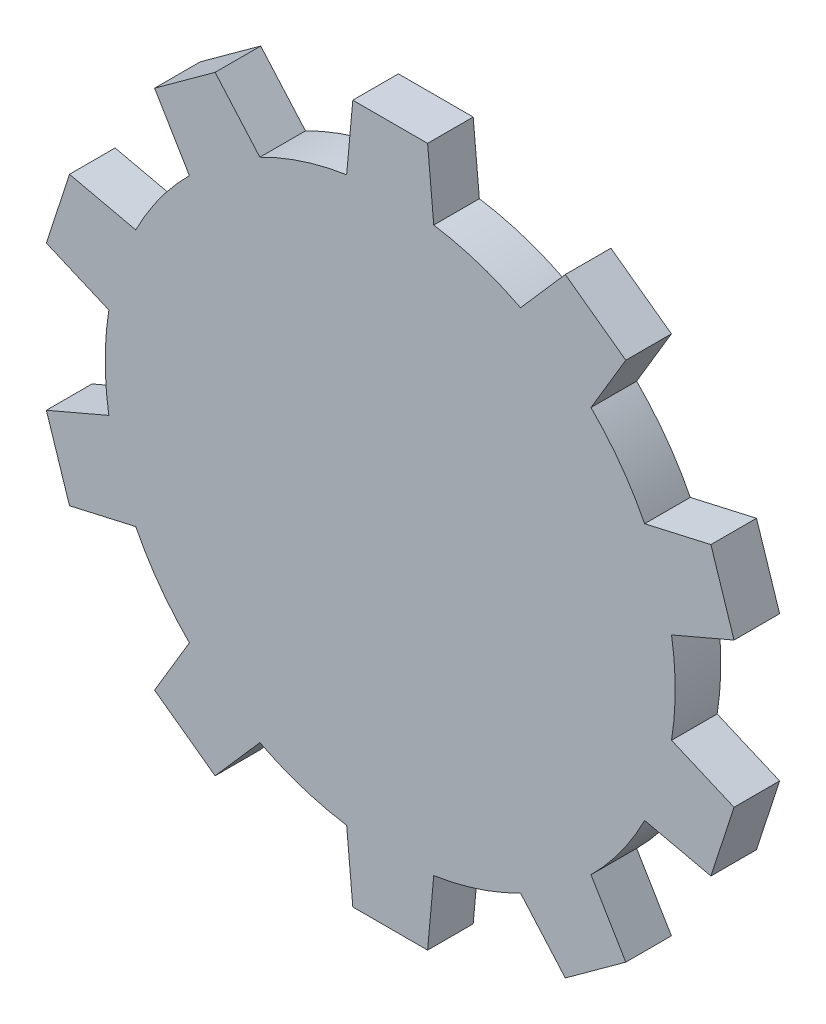
from build123d import *

# Parameters (mm, degrees)
SALIENTE_EXTRUIR1_DEPTH = 2


with BuildPart() as part:
    # Croquis1 → Saliente-Extruir1 (new body)
    with BuildSketch(Plane.XY):
        with BuildLine():
            Line((-1.909727018, 12.353256361), (-1.639945169, 15.320856699))
            Line((-1.639945169, 15.320856699), (1.639945169, 15.320856699))
            Line((1.639945169, 15.320856699), (1.909727018, 12.353256361))
            ThreePointArc((1.909727018, 12.353256361), (3.86271243, 11.888206454), (5.716060295, 11.116503709))
            Line((5.716060295, 11.116503709), (7.678630109, 13.358769022))
            Line((7.678630109, 13.358769022), (10.332117131, 11.430897853))
            Line((10.332117131, 11.430897853), (8.806063519, 8.871484955))
            ThreePointArc((8.806063519, 8.871484955), (10.11271243, 7.347315654), (11.158506856, 5.633624476))
            Line((11.158506856, 5.633624476), (14.064229672, 6.294085627))
            Line((14.064229672, 6.294085627), (15.077771526, 3.174724549))
            Line((15.077771526, 3.174724549), (12.338783063, 2.001107827))
            ThreePointArc((12.338783063, 2.001107827), (12.5, 0), (12.338783063, -2.001107827))
            Line((12.338783063, -2.001107827), (15.077771526, -3.174724549))
            Line((15.077771526, -3.174724549), (14.064229672, -6.294085627))
            Line((14.064229672, -6.294085627), (11.158506856, -5.633624476))
            ThreePointArc((11.158506856, -5.633624476), (10.11271243, -7.347315654), (8.806063519, -8.871484955))
            Line((8.806063519, -8.871484955), (10.332117131, -11.430897853))
            Line((10.332117131, -11.430897853), (7.678630109, -13.358769022))
            Line((7.678630109, -13.358769022), (5.716060295, -11.116503709))
            ThreePointArc((5.716060295, -11.116503709), (3.86271243, -11.888206454), (1.909727018, -12.353256361))
            Line((1.909727018, -12.353256361), (1.639945169, -15.320856699))
            Line((1.639945169, -15.320856699), (-1.639945169, -15.320856699))
            Line((-1.639945169, -15.320856699), (-1.909727018, -12.353256361))
            ThreePointArc((-1.909727018, -12.353256361), (-3.86271243, -11.888206454), (-5.716060295, -11.116503709))
            Line((-5.716060295, -11.116503709), (-7.678630109, -13.358769022))
            Line((-7.678630109, -13.358769022), (-10.332117131, -11.430897853))
            Line((-10.332117131, -11.430897853), (-8.806063519, -8.871484955))
            ThreePointArc((-8.806063519, -8.871484955), (-10.11271243, -7.347315654), (-11.158506856, -5.633624476))
            Line((-11.158506856, -5.633624476), (-14.064229672, -6.294085627))
            Line((-14.064229672, -6.294085627), (-15.077771526, -3.174724549))
            Line((-15.077771526, -3.174724549), (-12.338783063, -2.001107827))
            ThreePointArc((-12.338783063, -2.001107827), (-12.5, 0), (-12.338783063, 2.001107827))
            Line((-12.338783063, 2.001107827), (-15.077771526, 3.174724549))
            Line((-15.077771526, 3.174724549), (-14.064229672, 6.294085627))
            Line((-14.064229672, 6.294085627), (-11.158506856, 5.633624476))
            ThreePointArc((-11.158506856, 5.633624476), (-10.11271243, 7.347315654), (-8.806063519, 8.871484955))
            Line((-8.806063519, 8.871484955), (-10.332117131, 11.430897853))
            Line((-10.332117131, 11.430897853), (-7.678630109, 13.358769022))
            Line((-7.678630109, 13.358769022), (-5.716060295, 11.116503709))
            ThreePointArc((-5.716060295, 11.116503709), (-3.86271243, 11.888206454), (-1.909727018, 12.353256361))
        make_face()
    extrude(amount=SALIENTE_EXTRUIR1_DEPTH)


solid = part.part
